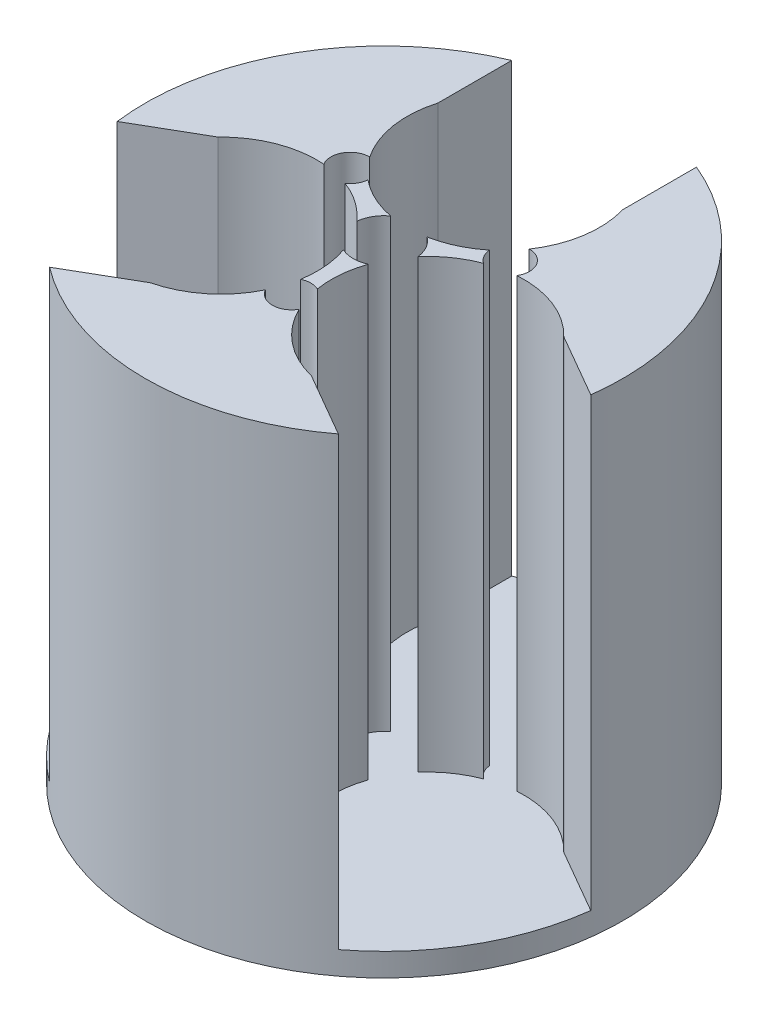
from build123d import *

# Parameters (mm, degrees)
SKETCH1_R           = 31
BOSS_EXTRUDE1_DEPTH = 50
SKETCH2_R           = 12.5
CUT_EXTRUDE1_DEPTH  = 50
CUT_EXTRUDE2_DEPTH  = 50
SKETCH4_R           = 4
SKETCH4_R_2         = 2.5
CUT_EXTRUDE3_DEPTH  = 67.498120274
SKETCH6_R           = 31
BOSS_EXTRUDE2_DEPTH = 3
BOSS_EXTRUDE3_DEPTH = 8


with BuildPart() as part:
    # Sketch1 → Boss-Extrude1 (new body)
    with BuildSketch(Plane(origin=(0, 0, 0), x_dir=(1, 0, 0), z_dir=(0, 1, 0))):
        with Locations(Location((0, 0, 0), (0, 0, 270))):
            Circle(SKETCH1_R)
    extrude(amount=BOSS_EXTRUDE1_DEPTH)

    # Sketch2 → Cut-Extrude1 (cut)
    with BuildSketch(Plane(origin=(0, 50, 0), x_dir=(1, 0, 0), z_dir=(0, 1, 0))):
        with Locations(Location((0, 15.5, 0), (0, 0, 270))):
            Circle(SKETCH2_R)
        with Locations(Location((13.423393759, -7.75, 0), (0, 0, 270))):
            Circle(SKETCH2_R)
        with Locations(Location((-13.423393759, -7.75, 0), (0, 0, 270))):
            Circle(SKETCH2_R)
    extrude(amount=-CUT_EXTRUDE1_DEPTH, mode=Mode.SUBTRACT)

    # Sketch3 → Cut-Extrude2 (cut)
    with BuildSketch(Plane(origin=(0, 50, 0), x_dir=(1, 0, 0), z_dir=(0, 1, 0))):
        with BuildLine():
            ThreePointArc((-12, 19), (0, 28), (12, 19))
            Line((12, 19), (12, 28.583211856))
            ThreePointArc((12, 28.583211856), (0, 31), (-12, 28.583211856))
            Line((-12, 28.583211856), (-12, 19))
        make_face()
        with BuildLine():
            ThreePointArc((18.753787589, -24.683910773), (26.846787517, -15.5), (30.753787589, -3.899301083))
            Line((30.753787589, -3.899301083), (22.454482672, 0.892304845))
            ThreePointArc((22.454482672, 0.892304845), (24.248711306, -14), (10.454482672, -19.892304845))
            Line((10.454482672, -19.892304845), (18.753787589, -24.683910773))
        make_face()
        with BuildLine():
            Line((-22.454482672, 0.892304845), (-30.753787589, -3.899301083))
            ThreePointArc((-30.753787589, -3.899301083), (-26.846787517, -15.5), (-18.753787589, -24.683910773))
            Line((-18.753787589, -24.683910773), (-10.454482672, -19.892304845))
            ThreePointArc((-10.454482672, -19.892304845), (-24.248711306, -14), (-22.454482672, 0.892304845))
        make_face()
    extrude(amount=-CUT_EXTRUDE2_DEPTH, mode=Mode.SUBTRACT)

    # Sketch4 → Cut-Extrude3 (cut, through all)
    with BuildSketch(Plane(origin=(0, 50, 0), x_dir=(1, 0, 0), z_dir=(0, 1, 0))):
        Circle(SKETCH4_R)
        with Locations((-10.392304845, 6)):
            Circle(SKETCH4_R_2)
        with Locations((10.392304845, 6)):
            Circle(SKETCH4_R_2)
        with Locations((0, -12)):
            Circle(SKETCH4_R_2)
    extrude(amount=-CUT_EXTRUDE3_DEPTH, mode=Mode.SUBTRACT)


with BuildPart() as cut_extrude3_piece_1:
    # of the separate pieces the step leaves, piece 1, a body of its own (cut_extrude3_pieces)
    add(part.part.solids().sort_by_distance((-12.538976962, 0, -4.718673022))[0])



with BuildPart() as cut_extrude3_piece_2:
    # of the separate pieces the step leaves, piece 2, a body of its own (cut_extrude3_pieces)
    add(part.part.solids().sort_by_distance((-18.753787589, 0, 24.683910773))[0])


with BuildPart() as cut_extrude3_piece_3:
    # of the separate pieces the step leaves, piece 3, a body of its own (cut_extrude3_pieces)
    add(part.part.solids().sort_by_distance((12.538976962, 0, -4.718673022))[0])


with BuildPart() as cut_extrude3_piece_4:
    # of the separate pieces the step leaves, piece 4, a body of its own (cut_extrude3_pieces)
    add(part.part.solids().sort_by_distance((3.976230514, 0, -0.43542037))[0])


with BuildPart() as cut_extrude3_piece_5:
    # of the separate pieces the step leaves, piece 5, a body of its own (cut_extrude3_pieces)
    add(part.part.solids().sort_by_distance((-3.976230514, 0, -0.43542037))[0])


with BuildPart() as cut_extrude3_piece_6:
    # of the separate pieces the step leaves, piece 6, a body of its own (cut_extrude3_pieces)
    add(part.part.solids().sort_by_distance((-1.083982046, 0, 9.747227725))[0])


with BuildPart() as cut_extrude3_piece_1_1:
    add(cut_extrude3_piece_1.part)

    add(cut_extrude3_piece_2.part)  # Boss-Extrude2 merges Cut-Extrude3 piece 2

    add(cut_extrude3_piece_3.part)  # Boss-Extrude2 merges Cut-Extrude3 piece 3

    add(cut_extrude3_piece_4.part)  # Boss-Extrude2 merges Cut-Extrude3 piece 4

    add(cut_extrude3_piece_5.part)  # Boss-Extrude2 merges Cut-Extrude3 piece 5

    add(cut_extrude3_piece_6.part)  # Boss-Extrude2 merges Cut-Extrude3 piece 6
    # Sketch6 → Boss-Extrude2 (add)
    with BuildSketch(Plane.XZ):
        with Locations(Location((0, 0, 0), (0, 0, 127.226027599))):
            Circle(SKETCH6_R)
    extrude(amount=BOSS_EXTRUDE2_DEPTH)

    # Sketch7 → Boss-Extrude3 (add)
    with BuildSketch(Plane(origin=(0, 50, 0), x_dir=(1, 0, 0), z_dir=(0, 1, 0))):
        with BuildLine():
            Line((-10.454482672, -19.892304845), (-18.753787589, -24.683910773))
            ThreePointArc((-18.753787589, -24.683910773), (0, -31), (18.753787589, -24.683910773))
            Line((18.753787589, -24.683910773), (10.454482672, -19.892304845))
            ThreePointArc((10.454482672, -19.892304845), (5.574105702, -17.478241208), (2.182997772, -13.218409097))
            ThreePointArc((2.182997772, -13.218409097), (0, -14.5), (-2.182997772, -13.218409097))
            ThreePointArc((-2.182997772, -13.218409097), (-5.574105702, -17.478241208), (-10.454482672, -19.892304845))
        make_face()
        with BuildLine():
            Line((22.454482672, 0.892304845), (30.753787589, -3.899301083))
            ThreePointArc((30.753787589, -3.899301083), (26.846787517, 15.5), (12, 28.583211856))
            Line((12, 28.583211856), (12, 19))
            ThreePointArc((12, 19), (12.349548049, 13.566437746), (10.35597919, 8.499736075))
            ThreePointArc((10.35597919, 8.499736075), (12.557368355, 7.25), (12.538976962, 4.718673022))
            ThreePointArc((12.538976962, 4.718673022), (17.923653751, 3.911803463), (22.454482672, 0.892304845))
        make_face()
        with BuildLine():
            Line((-12, 19), (-12, 28.583211856))
            ThreePointArc((-12, 28.583211856), (-26.846787517, 15.5), (-30.753787589, -3.899301083))
            Line((-30.753787589, -3.899301083), (-22.454482672, 0.892304845))
            ThreePointArc((-22.454482672, 0.892304845), (-17.923653751, 3.911803463), (-12.538976962, 4.718673022))
            ThreePointArc((-12.538976962, 4.718673022), (-12.557368355, 7.25), (-10.35597919, 8.499736075))
            ThreePointArc((-10.35597919, 8.499736075), (-12.349548049, 13.566437746), (-12, 19))
        make_face()
        with BuildLine():
            ThreePointArc((1.083982046, -9.747227725), (0, -9.5), (-1.083982046, -9.747227725))
            ThreePointArc((-1.083982046, -9.747227725), (-0.97000408, -6.671535571), (-1.611030155, -3.661226821))
            ThreePointArc((-1.611030155, -3.661226821), (0, -4), (1.611030155, -3.661226821))
            ThreePointArc((1.611030155, -3.661226821), (0.97000408, -6.671535571), (1.083982046, -9.747227725))
        make_face()
        with BuildLine():
            ThreePointArc((7.899355803, 5.812369851), (8.227241336, 4.75), (8.983337849, 3.934857873))
            ThreePointArc((8.983337849, 3.934857873), (6.262721327, 2.49571961), (3.976230514, 0.43542037))
            ThreePointArc((3.976230514, 0.43542037), (3.464101615, 2), (2.365200359, 3.225806452))
            ThreePointArc((2.365200359, 3.225806452), (5.292717247, 4.175815961), (7.899355803, 5.812369851))
        make_face()
        with BuildLine():
            ThreePointArc((-8.983337849, 3.934857873), (-8.227241336, 4.75), (-7.899355803, 5.812369851))
            ThreePointArc((-7.899355803, 5.812369851), (-5.292717247, 4.175815961), (-2.365200359, 3.225806452))
            ThreePointArc((-2.365200359, 3.225806452), (-3.464101615, 2), (-3.976230514, 0.43542037))
            ThreePointArc((-3.976230514, 0.43542037), (-6.262721327, 2.49571961), (-8.983337849, 3.934857873))
        make_face()
    extrude(amount=BOSS_EXTRUDE3_DEPTH)


solid = cut_extrude3_piece_1_1.part
